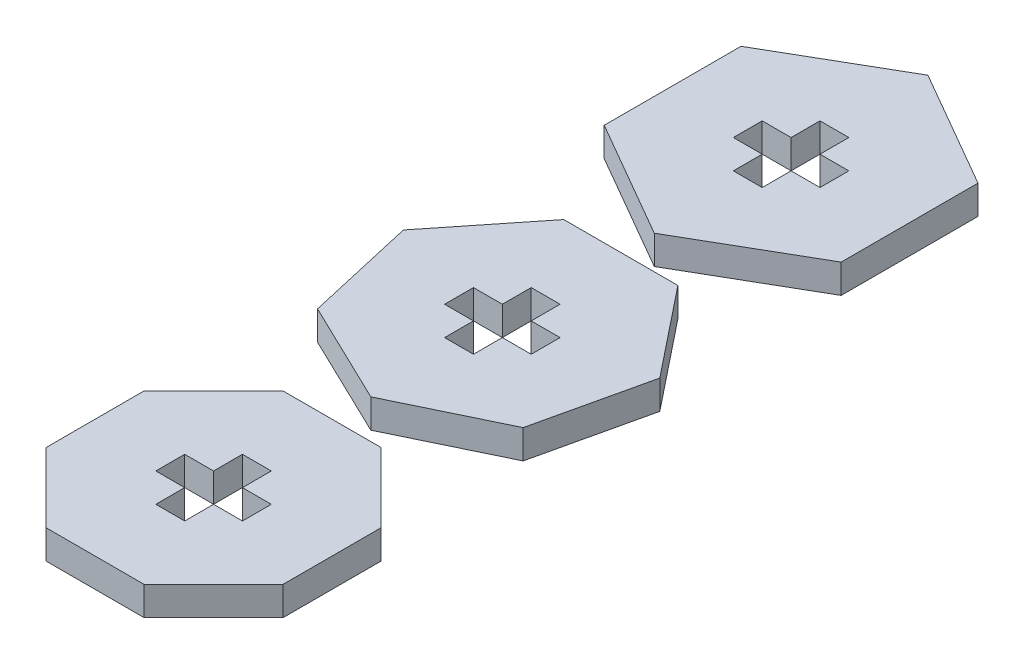
from build123d import *

# Parameters (mm, degrees)
BOSS_EXTRUDE1_DEPTH   = 5.08
BOSS_EXTRUDE1_2_DEPTH = 5.08
BOSS_EXTRUDE1_3_DEPTH = 5.08


with BuildPart() as part:
    # Sketch1 → Boss-Extrude1 (new body)
    with BuildSketch(Plane(origin=(0, 0, 0), x_dir=(1, 0, 0), z_dir=(0, 1, 0))):
        Polygon((-20.97553446, 14.451323935), (-0.13102446, 26.485907395), (-0.13102446, 50.555074314), (-20.97553446, 62.589657774), (-41.82004446, 50.555074314), (-41.82004446, 26.485907395), align=None)
        Polygon((-20.97553446, 46.140490854), (-18.43553446, 46.140490854), (-18.43553446, 41.060490854), (-13.35553446, 41.060490854), (-13.35553446, 38.520490854), (-13.35553446, 35.980490854), (-18.43553446, 35.980490854), (-18.43553446, 30.900490854), (-20.97553446, 30.900490854), (-23.51553446, 30.900490854), (-23.51553446, 35.980490854), (-28.59553446, 35.980490854), (-28.59553446, 38.520490854), (-28.59553446, 41.060490854), (-23.51553446, 41.060490854), (-23.51553446, 46.140490854), align=None, mode=Mode.SUBTRACT)
    extrude(amount=BOSS_EXTRUDE1_DEPTH)


with BuildPart() as body_2:
    # Sketch1 → Boss-Extrude1 2 (new body)
    with BuildSketch(Plane(origin=(0, 0, 0), x_dir=(1, 0, 0), z_dir=(0, 1, 0))):
        Polygon((-20.97553446, -35.415169813), (-2.887346582, -26.704357631), (1.580066892, -7.131340326), (-10.937347503, 8.565000854), (-31.013721418, 8.565000854), (-43.531135812, -7.131340326), (-39.063722338, -26.704357631), align=None)
        Polygon((-23.51553446, -14.819509146), (-28.59553446, -14.819509146), (-28.59553446, -12.279509146), (-28.59553446, -9.739509146), (-23.51553446, -9.739509146), (-23.51553446, -4.659509146), (-20.97553446, -4.659509146), (-18.43553446, -4.659509146), (-18.43553446, -9.739509146), (-13.35553446, -9.739509146), (-13.35553446, -12.279509146), (-13.35553446, -14.819509146), (-18.43553446, -14.819509146), (-18.43553446, -19.899509146), (-20.97553446, -19.899509146), (-23.51553446, -19.899509146), align=None, mode=Mode.SUBTRACT)
    extrude(amount=BOSS_EXTRUDE1_2_DEPTH)


with BuildPart() as body_3:
    # Sketch1 → Boss-Extrude1 3 (new body)
    with BuildSketch(Plane(origin=(0, 0, 0), x_dir=(1, 0, 0), z_dir=(0, 1, 0))):
        Polygon((-12.341455717, -42.234999146), (-29.609613203, -42.234999146), (-41.82004446, -54.445430403), (-41.82004446, -71.713587889), (-29.609613203, -83.924019146), (-12.341455717, -83.924019146), (-0.13102446, -71.713587889), (-0.13102446, -54.445430403), align=None)
        Polygon((-18.43553446, -65.619509146), (-18.43553446, -70.699509146), (-20.97553446, -70.699509146), (-23.51553446, -70.699509146), (-23.51553446, -65.619509146), (-28.59553446, -65.619509146), (-28.59553446, -63.079509146), (-28.59553446, -60.539509146), (-23.51553446, -60.539509146), (-23.51553446, -55.459509146), (-20.97553446, -55.459509146), (-18.43553446, -55.459509146), (-18.43553446, -60.539509146), (-13.35553446, -60.539509146), (-13.35553446, -63.079509146), (-13.35553446, -65.619509146), align=None, mode=Mode.SUBTRACT)
    extrude(amount=BOSS_EXTRUDE1_3_DEPTH)


solid = Compound([part.part, body_2.part, body_3.part])
